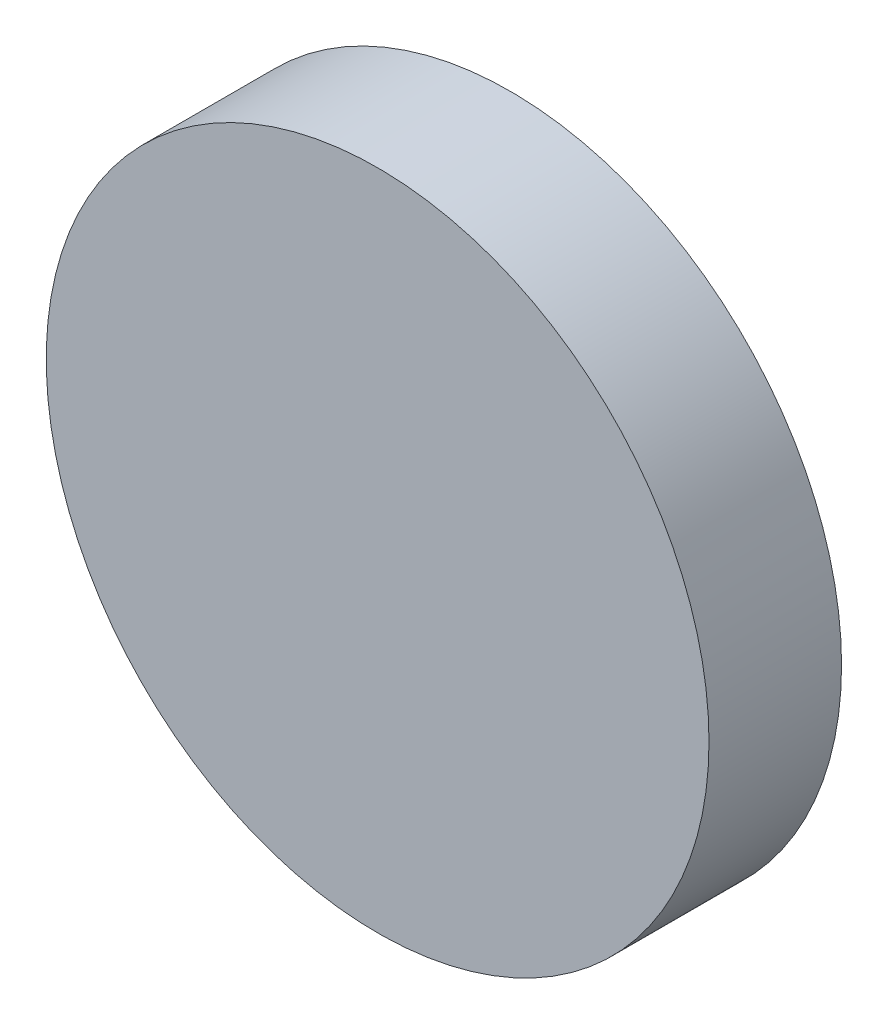
from build123d import *

# Parameters (mm, degrees)
SKETCH_1_R      = 30
EXTRUDE_1_DEPTH = 12


with BuildPart() as part:
    # 草图1 → 凸台-拉伸1 (new body)
    with BuildSketch(Plane.XY):
        Circle(SKETCH_1_R)
    extrude(amount=-EXTRUDE_1_DEPTH)


solid = part.part
